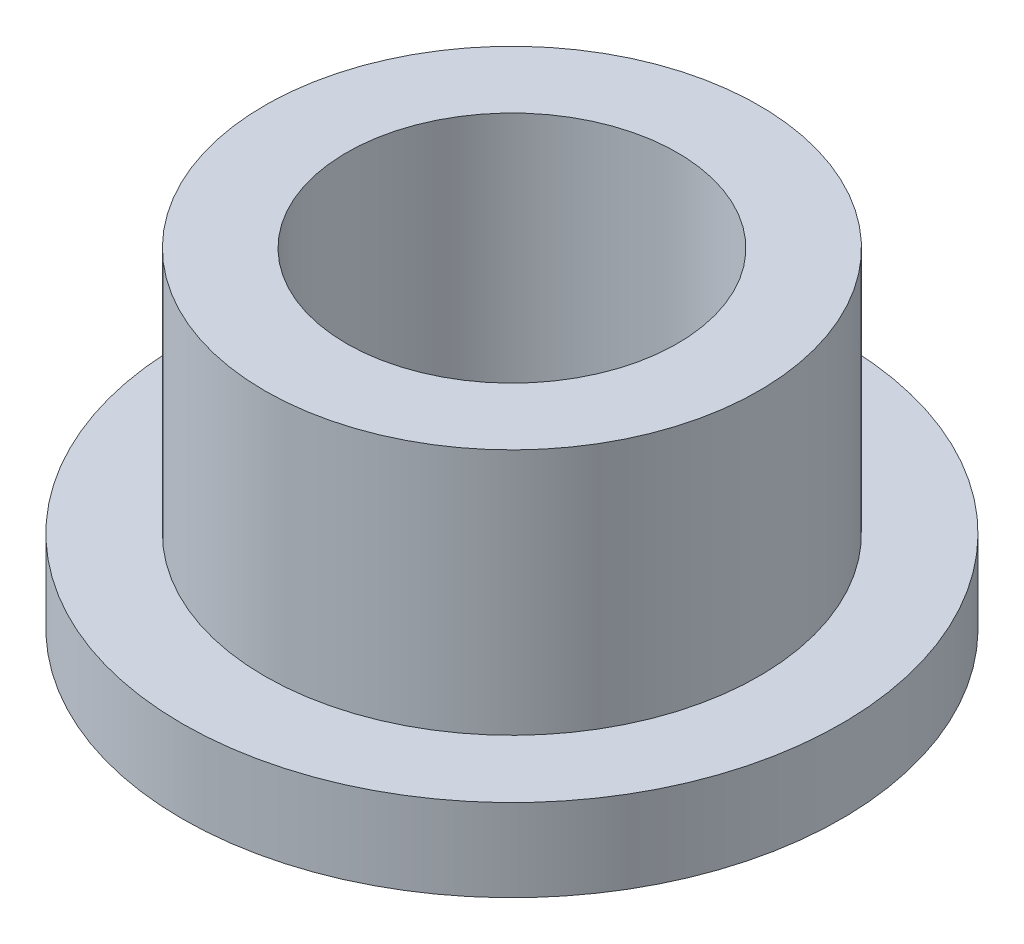
from build123d import *

# Parameters (mm, degrees)
SKETCH2_R           = 9.525
SKETCH2_R_2         = 6.3754
BOSS_EXTRUDE1_DEPTH = 12.7
SKETCH3_R           = 12.7
SKETCH3_R_2         = 9.525
BOSS_EXTRUDE2_DEPTH = 3.175


with BuildPart() as part:
    # Sketch2 → Boss-Extrude1 (new body)
    with BuildSketch(Plane(origin=(0, 0, 0), x_dir=(1, 0, 0), z_dir=(0, 1, 0))):
        with Locations(Location((0, 0, 0), (0, 0, 270))):
            Circle(SKETCH2_R)
        with Locations(Location((0, 0, 0), (0, 0, 270))):
            Circle(SKETCH2_R_2, mode=Mode.SUBTRACT)
    extrude(amount=BOSS_EXTRUDE1_DEPTH)

    # Sketch3 → Boss-Extrude2 (add)
    with BuildSketch(Plane(origin=(0, 0, 0), x_dir=(1, 0, 0), z_dir=(0, 1, 0))):
        with Locations(Location((0, 0, 0), (0, 0, 270))):
            Circle(SKETCH3_R)
        with Locations(Location((0, 0, 0), (0, 0, 270))):
            Circle(SKETCH3_R_2, mode=Mode.SUBTRACT)
    extrude(amount=BOSS_EXTRUDE2_DEPTH)


solid = part.part
